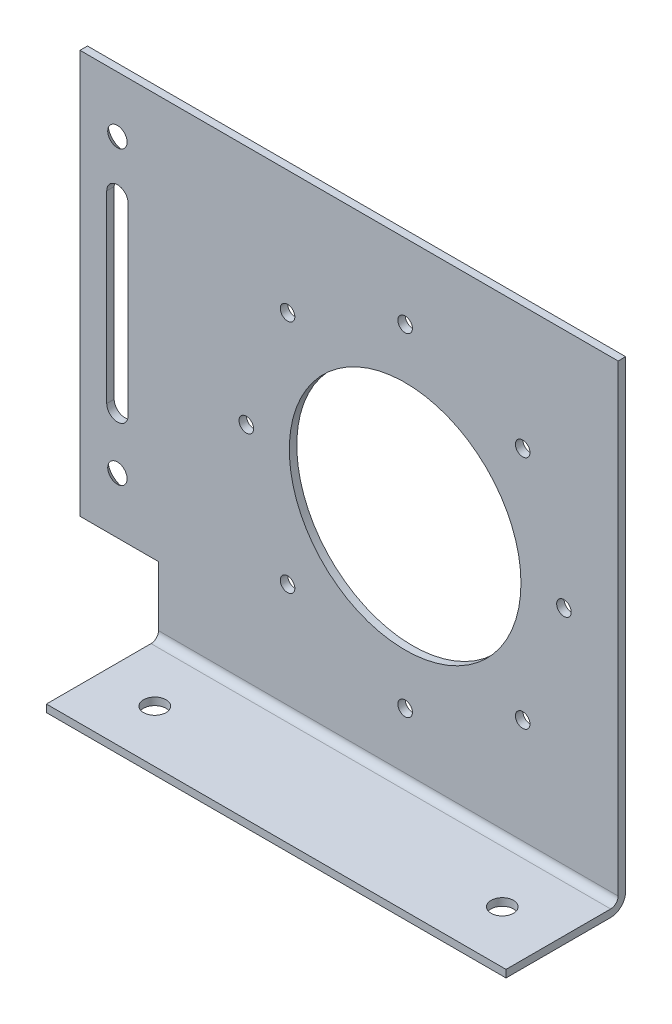
from build123d import *

# Parameters (mm, degrees)
AUFSATZ_LINEAR_AUSTRAGEN1_DEPTH                      = 2
SKIZZE2_W                                            = 123
SKIZZE2_H                                            = 2
AUFSATZ_LINEAR_AUSTRAGEN2_DEPTH                      = 30
VERRUNDUNG1_R                                        = 2
VERRUNDUNG2_R                                        = 4
SKIZZE3_R                                            = 3
SCHNITT_LINEAR_AUSTRAGEN1_DEPTH                      = 152.345576266
FORMSENKUNG_F_R_M4_SENKSCHRAUBE_MIT_INNE_D           = 4.5
FORMSENKUNG_F_R_M4_SENKSCHRAUBE_MIT_INNE_DEPTH       = 11.94
FORMSENKUNG_F_R_M4_SENKSCHRAUBE_MIT_INNE_CSINK_D     = 9.18
FORMSENKUNG_F_R_M4_SENKSCHRAUBE_MIT_INNE_CSINK_ANGLE = 90
FORMSENKUNG_F_R_M4_SENKSCHRAUBE_MIT_INNE_TIP         = 1.351936393
SKIZZE7_R                                            = 1.95
SKIZZE7_R_2                                          = 31
SCHNITT_LINEAR_AUSTRAGEN2_DEPTH                      = 106.295533596


with BuildPart() as part:
    # Skizze1 → Aufsatz-Linear austragen1 (new body)
    with BuildSketch(Plane.XY):
        Polygon((-69.023447297, -46.645824625), (-48.023447297, -46.645824625), (-48.023447297, -66.645824625), (74.976552703, -66.645824625), (74.976552703, 61.354175375), (-69.023447297, 61.354175375), align=None)
    extrude(amount=AUFSATZ_LINEAR_AUSTRAGEN1_DEPTH)

    # Skizze2 → Aufsatz-Linear austragen2 (add)
    with BuildSketch(Plane(origin=(0, 0, 0), x_dir=(-1, 0, 0), z_dir=(0, 0, -1))):
        with Locations((-13.476552703, -65.645824625)):
            Rectangle(SKIZZE2_W, SKIZZE2_H)
    extrude(amount=AUFSATZ_LINEAR_AUSTRAGEN2_DEPTH)

    # Verrundung1
    verrundung1_edges = [part.edges().sort_by_distance(p)[0] for p in [
        (13.476552703, -64.645824625, 0),
    ]]
    fillet(verrundung1_edges, radius=VERRUNDUNG1_R)

    # Verrundung2
    verrundung2_edges = [part.edges().sort_by_distance(p)[0] for p in [
        (13.476552703, -66.645824625, 2),
    ]]
    fillet(verrundung2_edges, radius=VERRUNDUNG2_R)

    # Skizze3 → Schnitt-Linear austragen1 (cut, through all)
    with BuildSketch(Plane.XZ.offset(66.645824625)):
        with Locations((-33.023447297, -16)):
            Circle(SKIZZE3_R)
        with Locations((59.976552703, -16)):
            Circle(SKIZZE3_R)
    extrude(amount=-SCHNITT_LINEAR_AUSTRAGEN1_DEPTH, mode=Mode.SUBTRACT)

    # Formsenkung für M4 Senkschraube mit Innensechskant1
    with Locations(Plane.XY.offset(2)):
        with Locations((-59.023447297, -31.645824625), (-59.023447297, 46.354175375)):
            CounterSinkHole(FORMSENKUNG_F_R_M4_SENKSCHRAUBE_MIT_INNE_D / 2, FORMSENKUNG_F_R_M4_SENKSCHRAUBE_MIT_INNE_CSINK_D / 2, depth=FORMSENKUNG_F_R_M4_SENKSCHRAUBE_MIT_INNE_DEPTH, counter_sink_angle=FORMSENKUNG_F_R_M4_SENKSCHRAUBE_MIT_INNE_CSINK_ANGLE)
            with Locations((0, 0, -(FORMSENKUNG_F_R_M4_SENKSCHRAUBE_MIT_INNE_DEPTH + FORMSENKUNG_F_R_M4_SENKSCHRAUBE_MIT_INNE_TIP / 2))):  # 118° drill point
                Cone(0, FORMSENKUNG_F_R_M4_SENKSCHRAUBE_MIT_INNE_D / 2, FORMSENKUNG_F_R_M4_SENKSCHRAUBE_MIT_INNE_TIP, mode=Mode.SUBTRACT)

    # Skizze7 → Schnitt-Linear austragen2 (cut, through all)
    with BuildSketch(Plane.XY.offset(2)):
        with Locations((17.976552703, 41.354175375)):
            Circle(SKIZZE7_R)
        with Locations((49.442804466, 28.320427137)):
            Circle(SKIZZE7_R)
        with Locations((49.442804466, -34.612076388)):
            Circle(SKIZZE7_R)
        with Locations((17.976552703, -47.645824625)):
            Circle(SKIZZE7_R)
        with Locations((-13.489699059, -34.612076388)):
            Circle(SKIZZE7_R)
        with Locations((-13.489699059, 28.320427137)):
            Circle(SKIZZE7_R)
        with Locations((17.976552703, -3.145824625)):
            Circle(SKIZZE7_R_2)
        with Locations((-24.523447297, -3.145824625)):
            Circle(SKIZZE7_R)
        with Locations((60.476552703, -3.145824625)):
            Circle(SKIZZE7_R)
        with BuildLine():
            Line((-61.881657041, -16.935182234), (-61.881657041, 32.354175375))
            ThreePointArc((-61.881657041, 32.354175375), (-59.023447297, 35.212385119), (-56.165237552, 32.354175375))
            Line((-56.165237552, 32.354175375), (-56.165237552, -16.935182234))
            ThreePointArc((-56.165237552, -16.935182234), (-59.023447297, -19.793391979), (-61.881657041, -16.935182234))
        make_face()
    extrude(amount=-SCHNITT_LINEAR_AUSTRAGEN2_DEPTH, mode=Mode.SUBTRACT)


with BuildPart() as body_2:
    # Spiegeln2: mirrored copy
    add(part.part.mirror(Plane.XY.offset(2)))


solid = body_2.part
